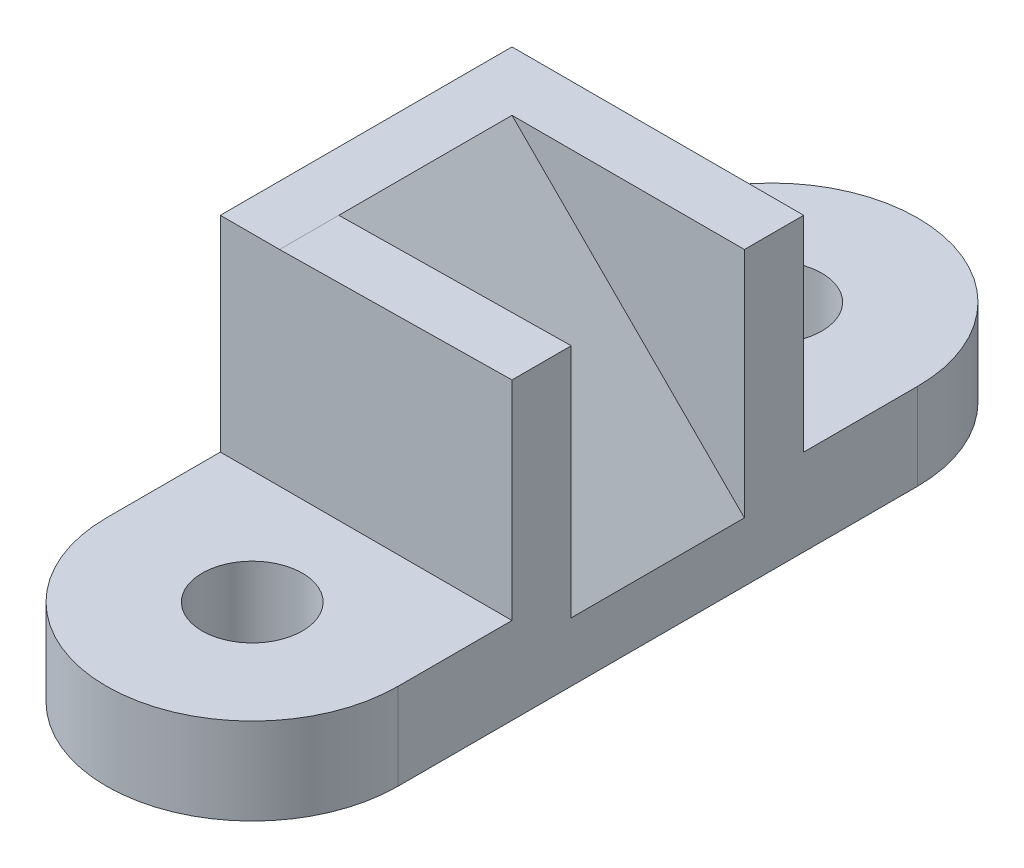
from build123d import *

# Parameters (mm, degrees)
BOSS_EXTRUDE1_DEPTH = 19
SKETCH2_R           = 11
CUT_EXTRUDE1_DEPTH  = 19
SKETCH3_R           = 11
CUT_EXTRUDE3_DEPTH  = 422
SKETCH4_W           = 64
SKETCH4_H           = 64
BOSS_EXTRUDE2_DEPTH = 45
CUT_EXTRUDE4_DEPTH  = 51
BOSS_EXTRUDE3_DEPTH = 13


with BuildPart() as part:
    # Sketch1 → Boss-Extrude1 (new body)
    with BuildSketch(Plane(origin=(0, 0, 0), x_dir=(1, 0, 0), z_dir=(0, 1, 0))):
        with BuildLine():
            Line((-32, 114), (-32, 0))
            ThreePointArc((-32, 0), (0, -32), (32, 0))
            Line((32, 0), (32, 114))
            ThreePointArc((32, 114), (0, 146), (-32, 114))
        make_face()
    extrude(amount=BOSS_EXTRUDE1_DEPTH)

    # Sketch2 → Cut-Extrude1 (cut)
    with BuildSketch(Plane(origin=(0, 19, 0), x_dir=(1, 0, 0), z_dir=(0, 1, 0))):
        with Locations(Location((0, 0, 0), (0, 0, 270))):
            Circle(SKETCH2_R)
    extrude(amount=-CUT_EXTRUDE1_DEPTH, mode=Mode.SUBTRACT)

    # Sketch3 → Cut-Extrude3 (cut)
    with BuildSketch(Plane(origin=(0, 19, 0), x_dir=(1, 0, 0), z_dir=(0, 1, 0))):
        with Locations(Location((0, 114, 0), (0, 0, 270))):
            Circle(SKETCH3_R)
    extrude(amount=-CUT_EXTRUDE3_DEPTH, mode=Mode.SUBTRACT)

    # Sketch4 → Boss-Extrude2 (add)
    with BuildSketch(Plane(origin=(0, 19, 0), x_dir=(1, 0, 0), z_dir=(0, 1, 0))):
        with Locations((0, 57)):
            Rectangle(SKETCH4_W, SKETCH4_H)
    extrude(amount=BOSS_EXTRUDE2_DEPTH)

    # Sketch5 → Cut-Extrude4 (cut)
    with BuildSketch(Plane.XY.offset(-25)):
        Polygon((32, 64), (-19, 64), (32, 13), align=None)
    extrude(amount=-CUT_EXTRUDE4_DEPTH, mode=Mode.SUBTRACT)

    # Sketch6 → Boss-Extrude3 (add)
    with BuildSketch(Plane.XY.offset(-25)):
        Polygon((32, 13), (32, 64.70943725), (-19, 64), align=None)
    extrude(amount=-BOSS_EXTRUDE3_DEPTH)


solid = part.part
